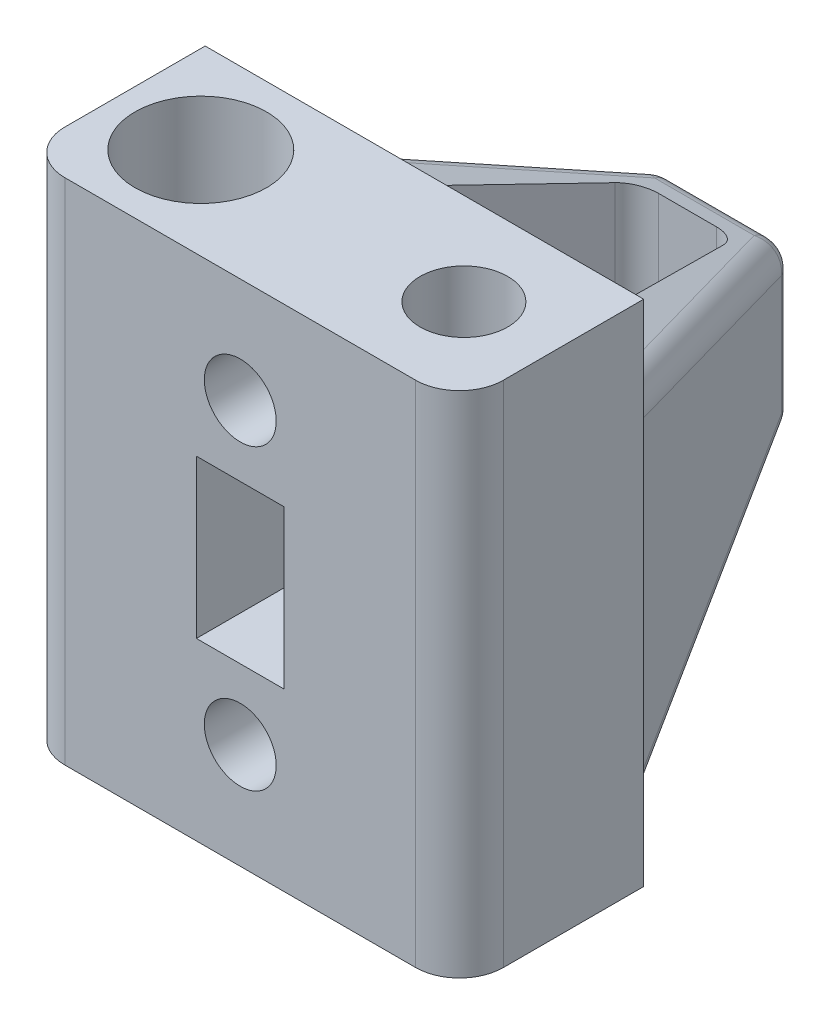
from build123d import *

# Parameters (mm, degrees)
SKETCH1_W           = 50
SKETCH1_H           = 21
BOSS_EXTRUDE1_DEPTH = 58
SKETCH3_R           = 7.5
CUT_EXTRUDE1_DEPTH  = 24
CUT_EXTRUDE2_REACH  = 66.025
SKETCH4_R           = 5
CUT_EXTRUDE3_START  = -24
SKETCH5_R           = 7.5
CUT_EXTRUDE3_DEPTH  = 24
CUT_EXTRUDE4_REACH  = 66.025
SKETCH6_R           = 4.5
CUT_EXTRUDE5_REACH  = 68.558
SKETCH8_W           = 10
SKETCH8_H           = 18
BOSS_EXTRUDE3_DEPTH = 20
CUT_EXTRUDE6_DEPTH  = 37.5
CUT_EXTRUDE7_REACH  = 85.75
SKETCH13_R          = 2
SKETCH7_R           = 4.1
CUT_EXTRUDE8_DEPTH  = 15
FILLET1_R           = 5
FILLET2_R           = 3
FILLET3_R           = 3
FILLET4_R           = 3


with BuildPart() as part:
    # Sketch1 → Boss-Extrude1 (new body)
    with BuildSketch(Plane(origin=(0, 0, 0), x_dir=(1, 0, 0), z_dir=(0, 1, 0))):
        Rectangle(SKETCH1_W, SKETCH1_H)
    extrude(amount=BOSS_EXTRUDE1_DEPTH)

    # Sketch3 → Cut-Extrude1 (cut)
    with BuildSketch(Plane(origin=(0, 58, 0), x_dir=(1, 0, 0), z_dir=(0, 1, 0))):
        with Locations(Location((-15, 0, 0), (0, 0, 270))):
            Circle(SKETCH3_R)
    extrude(amount=-CUT_EXTRUDE1_DEPTH, mode=Mode.SUBTRACT)

    # Sketch4 → Cut-Extrude2 (cut, up to next)
    with BuildSketch(Plane(origin=(0, 58, 0), x_dir=(1, 0, 0), z_dir=(0, 1, 0)), mode=Mode.PRIVATE) as cut_extrude2_sk1:
        with Locations(Location((15, 0, 0), (0, 0, 270))):
            Circle(SKETCH4_R)
    cut_extrude2_tool1 = extrude(cut_extrude2_sk1.sketch, amount=-CUT_EXTRUDE2_REACH, mode=Mode.PRIVATE) & part.part
    add(cut_extrude2_tool1.solids().sort_by_distance((15, 58, 0))[0], mode=Mode.SUBTRACT)

    # Sketch5 → Cut-Extrude3 (cut)
    with BuildSketch(Plane.XZ.offset(CUT_EXTRUDE3_START)):
        with Locations(Location((-15, 0, 0), (0, 0, 90))):
            Circle(SKETCH5_R)
    extrude(amount=CUT_EXTRUDE3_DEPTH, mode=Mode.SUBTRACT)

    # Sketch6 → Cut-Extrude4 (cut, up to next)
    with BuildSketch(Plane.XZ, mode=Mode.PRIVATE) as cut_extrude4_sk1:
        with Locations(Location((-15, 0, 0), (0, 0, 270))):
            Circle(SKETCH6_R)
    cut_extrude4_tool1 = extrude(cut_extrude4_sk1.sketch, amount=-CUT_EXTRUDE4_REACH, mode=Mode.PRIVATE) & part.part
    add(cut_extrude4_tool1.solids().sort_by_distance((-15, 0, 0))[0], mode=Mode.SUBTRACT)

    # Sketch8 → Cut-Extrude5 (cut, up to next)
    with BuildSketch(Plane.XY.offset(10.5), mode=Mode.PRIVATE) as cut_extrude5_sk1:
        with Locations((0, 29)):
            Rectangle(SKETCH8_W, SKETCH8_H)
    cut_extrude5_tool1 = extrude(cut_extrude5_sk1.sketch, amount=-CUT_EXTRUDE5_REACH, mode=Mode.PRIVATE) & part.part
    add(cut_extrude5_tool1.solids().sort_by_distance((0, 29, 10.5))[0], mode=Mode.SUBTRACT)

    # Sketch11 → Boss-Extrude3 (add, symmetric)
    with BuildSketch(Plane(origin=(0, 29, 0), x_dir=(0, 0, -1), z_dir=(0, 1, 0))):
        Polygon((40.5, 5.5), (40.5, -5.5), (10.5, -15), (10.5, -25), (44.5, -7.5), (44.5, 7.5), (10.5, 25), (10.5, 15), align=None)
    extrude(amount=BOSS_EXTRUDE3_DEPTH, both=True)

    # Sketch12 → Cut-Extrude6 (cut, symmetric)
    with BuildSketch(Plane.ZY):
        Polygon((-44.5, 38), (-10.5, 49), (-44.5, 49), align=None)
        Polygon((-44.5, 20), (-10.5, 9), (-44.5, 9), align=None)
    extrude(amount=CUT_EXTRUDE6_DEPTH, both=True, mode=Mode.SUBTRACT)

    # Sketch13 → Cut-Extrude7 (cut, up to next)
    with BuildSketch(Plane(origin=(0, 0, -44.5), x_dir=(-1, 0, 0), z_dir=(0, 0, -1)), mode=Mode.PRIVATE) as cut_extrude7_sk1:
        with Locations((0, 29)):
            Circle(SKETCH13_R)
    cut_extrude7_tool1 = extrude(cut_extrude7_sk1.sketch, amount=-CUT_EXTRUDE7_REACH, mode=Mode.PRIVATE) & part.part
    add(cut_extrude7_tool1.solids().sort_by_distance((0, 29, -44.5))[0], mode=Mode.SUBTRACT)

    # Sketch7 → Cut-Extrude8 (cut)
    with BuildSketch(Plane.XY.offset(10.5)):
        with Locations((0, 46)):
            Circle(SKETCH7_R)
        with Locations(Location((0, 12, 0), (0, 0, 180))):
            Circle(SKETCH7_R)
    extrude(amount=-CUT_EXTRUDE8_DEPTH, mode=Mode.SUBTRACT)

    # Fillet1
    fillet1_edges = [part.edges().sort_by_distance(p)[0] for p in [
        (25, 29, 10.5),
        (-25, 29, 10.5),
    ]]
    fillet(fillet1_edges, radius=FILLET1_R)

    # Fillet2
    fillet2_edges = [part.edges().sort_by_distance(p)[0] for p in [
        (-7.5, 29, -44.5),
        (7.5, 29, -44.5),
        (16.25, 14.5, -27.5),
        (0, 20, -44.5),
        (-16.25, 14.5, -27.5),
        (0, 38, -44.5),
        (-16.25, 43.5, -27.5),
        (16.25, 43.5, -27.5),
    ]]
    fillet(fillet2_edges, radius=FILLET2_R)

    # Fillet3
    fillet3_edges = [part.edges().sort_by_distance(p)[0] for p in [
        (5.5, 29, -40.5),
        (-5.5, 29, -40.5),
    ]]
    fillet(fillet3_edges, radius=FILLET3_R)

    # Fillet4
    fillet4_edges = [part.edges().sort_by_distance(p)[0] for p in [
        (-15, 29, -10.5),
        (15, 29, -10.5),
    ]]
    fillet(fillet4_edges, radius=FILLET4_R)


solid = part.part
